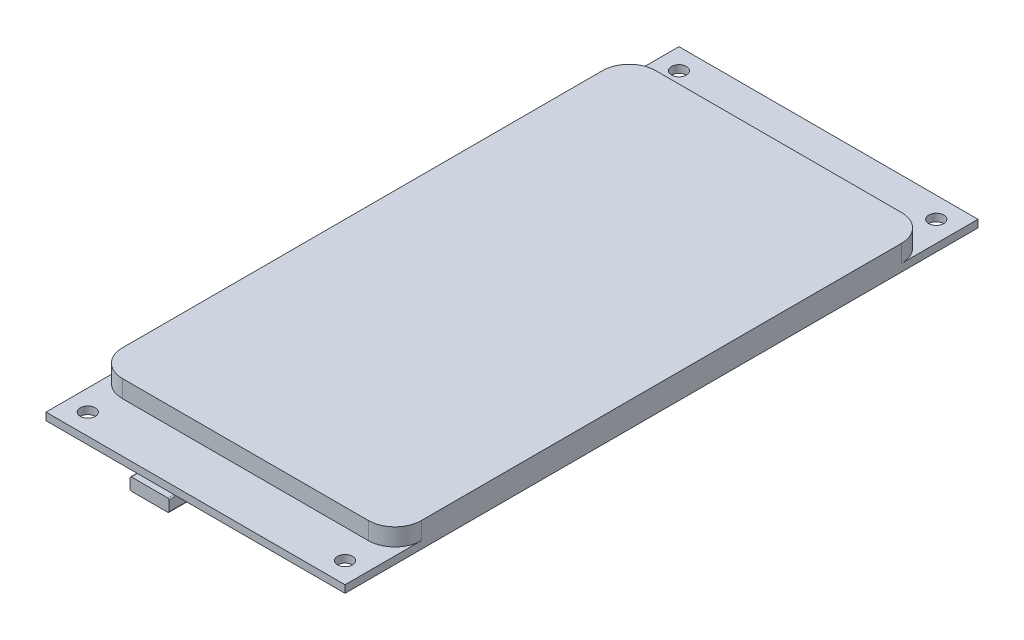
from build123d import *

# Parameters (mm, degrees)
SKETCH1_W            = 60
SKETCH1_H            = 127
BOSS_EXTRUDE1_DEPTH  = 1.5
CUT_EXTRUDE1_REACH   = 142.468
SKETCH2_R            = 1.5
BOSS_EXTRUDE2_DEPTH  = 3.5
BOSS_EXTRUDE3_DEPTH  = 4.8
BOSS_EXTRUDE4_DEPTH  = 1.2
SKETCH5_W            = 14.4
SKETCH5_H            = 2
BOSS_EXTRUDE5_DEPTH  = 14.5
BOSS_EXTRUDE6_DEPTH  = 1.4
BOSS_EXTRUDE7_DEPTH  = 7.6
SKETCH7_W            = 6.4
SKETCH7_H            = 5.3
BOSS_EXTRUDE8_DEPTH  = 15
SKETCH8_R            = 2.45
BOSS_EXTRUDE9_DEPTH  = 1
SKETCH5_2_W          = 14.4
SKETCH5_2_H          = 2
BOSS_EXTRUDE10_DEPTH = 0.25
SKETCH9_W            = 5.8
SKETCH9_H            = 12
BOSS_EXTRUDE11_DEPTH = 5.8


with BuildPart() as part:
    # Sketch1 → Boss-Extrude1 (new body)
    with BuildSketch(Plane(origin=(0, 0, 0), x_dir=(1, 0, 0), z_dir=(0, 1, 0))):
        with Locations((30, 63.5)):
            Rectangle(SKETCH1_W, SKETCH1_H)
    extrude(amount=BOSS_EXTRUDE1_DEPTH)

    # Sketch2 → Cut-Extrude1 (cut, up to next)
    with BuildSketch(Plane(origin=(0, 1.5, 0), x_dir=(1, 0, 0), z_dir=(0, 1, 0)), mode=Mode.PRIVATE) as cut_extrude1_sk1:
        with Locations((4.19, 122.81)):
            Circle(SKETCH2_R)
    cut_extrude1_tool1 = extrude(cut_extrude1_sk1.sketch, amount=-CUT_EXTRUDE1_REACH, mode=Mode.PRIVATE) & part.part
    # Sketch2 → Cut-Extrude1 (cut, up to next)
    with BuildSketch(Plane(origin=(0, 1.5, 0), x_dir=(1, 0, 0), z_dir=(0, 1, 0)), mode=Mode.PRIVATE) as cut_extrude1_sk2:
        with Locations((55.81, 122.81)):
            Circle(SKETCH2_R)
    cut_extrude1_tool2 = extrude(cut_extrude1_sk2.sketch, amount=-CUT_EXTRUDE1_REACH, mode=Mode.PRIVATE) & part.part
    # Sketch2 → Cut-Extrude1 (cut, up to next)
    with BuildSketch(Plane(origin=(0, 1.5, 0), x_dir=(1, 0, 0), z_dir=(0, 1, 0)), mode=Mode.PRIVATE) as cut_extrude1_sk3:
        with Locations((4.19, 4.19)):
            Circle(SKETCH2_R)
    cut_extrude1_tool3 = extrude(cut_extrude1_sk3.sketch, amount=-CUT_EXTRUDE1_REACH, mode=Mode.PRIVATE) & part.part
    # Sketch2 → Cut-Extrude1 (cut, up to next)
    with BuildSketch(Plane(origin=(0, 1.5, 0), x_dir=(1, 0, 0), z_dir=(0, 1, 0)), mode=Mode.PRIVATE) as cut_extrude1_sk4:
        with Locations((55.81, 4.19)):
            Circle(SKETCH2_R)
    cut_extrude1_tool4 = extrude(cut_extrude1_sk4.sketch, amount=-CUT_EXTRUDE1_REACH, mode=Mode.PRIVATE) & part.part
    add(cut_extrude1_tool1.solids().sort_by_distance((4.19, 1.5, -122.81))[0], mode=Mode.SUBTRACT)
    add(cut_extrude1_tool2.solids().sort_by_distance((55.81, 1.5, -122.81))[0], mode=Mode.SUBTRACT)
    add(cut_extrude1_tool3.solids().sort_by_distance((4.19, 1.5, -4.19))[0], mode=Mode.SUBTRACT)
    add(cut_extrude1_tool4.solids().sort_by_distance((55.81, 1.5, -4.19))[0], mode=Mode.SUBTRACT)

    # Sketch3 → Boss-Extrude2 (add)
    with BuildSketch(Plane(origin=(0, 1.5, 0), x_dir=(1, 0, 0), z_dir=(0, 1, 0))):
        with BuildLine():
            Line((5.324675365, 117), (54.675324635, 117))
            ThreePointArc((54.675324635, 117), (58.440438693, 115.440438693), (60, 111.675324635))
            Line((60, 111.675324635), (60, 15.324675365))
            ThreePointArc((60, 15.324675365), (58.440438693, 11.559561307), (54.675324635, 10))
            Line((54.675324635, 10), (5.324675365, 10))
            ThreePointArc((5.324675365, 10), (1.559561307, 11.559561307), (0, 15.324675365))
            Line((0, 15.324675365), (0, 111.675324635))
            ThreePointArc((0, 111.675324635), (1.559561307, 115.440438693), (5.324675365, 117))
        make_face()
    extrude(amount=BOSS_EXTRUDE2_DEPTH)



with BuildPart() as body_2:
    # Sketch4 → Boss-Extrude3 (new body)
    with BuildSketch(Plane.XY):
        with BuildLine():
            Line((18.35, 0), (25.65, 0))
            ThreePointArc((25.65, 0), (25.826776695, -0.073223305), (25.9, -0.25))
            Line((25.9, -0.25), (25.9, -2.25))
            ThreePointArc((25.9, -2.25), (25.826776695, -2.426776695), (25.65, -2.5))
            Line((25.65, -2.5), (18.35, -2.5))
            ThreePointArc((18.35, -2.5), (18.173223305, -2.426776695), (18.1, -2.25))
            Line((18.1, -2.25), (18.1, -0.25))
            ThreePointArc((18.1, -0.25), (18.173223305, -0.073223305), (18.35, 0))
        make_face()
    extrude(amount=-BOSS_EXTRUDE3_DEPTH)


with BuildPart() as part_1:
    add(part.part)

    add(body_2.part)  # Boss-Extrude4 merges body 2
    # Sketch4<2> → Boss-Extrude4 (add)
    with BuildSketch(Plane.XY):
        with BuildLine():
            Line((18.35, 0), (25.65, 0))
            ThreePointArc((25.65, 0), (25.826776695, -0.073223305), (25.9, -0.25))
            Line((25.9, -0.25), (25.9, -2.25))
            ThreePointArc((25.9, -2.25), (25.826776695, -2.426776695), (25.65, -2.5))
            Line((25.65, -2.5), (18.35, -2.5))
            ThreePointArc((18.35, -2.5), (18.173223305, -2.426776695), (18.1, -2.25))
            Line((18.1, -2.25), (18.1, -0.25))
            ThreePointArc((18.1, -0.25), (18.173223305, -0.073223305), (18.35, 0))
        make_face()
    extrude(amount=BOSS_EXTRUDE4_DEPTH)

    # Sketch5 → Boss-Extrude5 (add)
    with BuildSketch(Plane.ZY):
        with Locations((-35.3, -1)):
            Rectangle(SKETCH5_W, SKETCH5_H)
    extrude(amount=-BOSS_EXTRUDE5_DEPTH)



with BuildPart() as body_2_2:
    # Sketch6 → Boss-Extrude6 (new body)
    with BuildSketch(Plane(origin=(0, 0, -127), x_dir=(-1, 0, 0), z_dir=(0, 0, -1))):
        with BuildLine():
            Line((-28.308670428, 0), (-34.2, 0))
            ThreePointArc((-34.2, 0), (-34.376776695, -0.073223305), (-34.45, -0.25))
            Line((-34.45, -0.25), (-34.45, -1.65))
            ThreePointArc((-34.45, -1.65), (-34.523223305, -1.826776695), (-34.7, -1.9))
            Line((-34.7, -1.9), (-34.75, -1.9))
            ThreePointArc((-34.75, -1.9), (-34.926776695, -1.973223305), (-35, -2.15))
            Line((-35, -2.15), (-35, -3.55))
            ThreePointArc((-35, -3.55), (-34.926776695, -3.726776695), (-34.75, -3.8))
            Line((-34.75, -3.8), (-27.75, -3.8))
            ThreePointArc((-27.75, -3.8), (-27.573223305, -3.726776695), (-27.5, -3.55))
            Line((-27.5, -3.55), (-27.5, -2.15))
            ThreePointArc((-27.5, -2.15), (-27.573223305, -1.973223305), (-27.75, -1.9))
            Line((-27.75, -1.9), (-27.808670428, -1.9))
            ThreePointArc((-27.808670428, -1.9), (-27.985447123, -1.826776695), (-28.058670428, -1.65))
            Line((-28.058670428, -1.65), (-28.058670428, -0.25))
            ThreePointArc((-28.058670428, -0.25), (-28.131893732, -0.073223305), (-28.308670428, 0))
        make_face()
    extrude(amount=BOSS_EXTRUDE6_DEPTH)


with BuildPart() as part_2:
    add(part_1.part)

    add(body_2_2.part)  # Boss-Extrude7 merges body 2 2
    # Sketch6<3> → Boss-Extrude7 (add)
    with BuildSketch(Plane(origin=(0, 0, -127), x_dir=(-1, 0, 0), z_dir=(0, 0, -1))):
        with BuildLine():
            Line((-28.308670428, 0), (-34.2, 0))
            ThreePointArc((-34.2, 0), (-34.376776695, -0.073223305), (-34.45, -0.25))
            Line((-34.45, -0.25), (-34.45, -1.65))
            ThreePointArc((-34.45, -1.65), (-34.523223305, -1.826776695), (-34.7, -1.9))
            Line((-34.7, -1.9), (-34.75, -1.9))
            ThreePointArc((-34.75, -1.9), (-34.926776695, -1.973223305), (-35, -2.15))
            Line((-35, -2.15), (-35, -3.55))
            ThreePointArc((-35, -3.55), (-34.926776695, -3.726776695), (-34.75, -3.8))
            Line((-34.75, -3.8), (-27.75, -3.8))
            ThreePointArc((-27.75, -3.8), (-27.573223305, -3.726776695), (-27.5, -3.55))
            Line((-27.5, -3.55), (-27.5, -2.15))
            ThreePointArc((-27.5, -2.15), (-27.573223305, -1.973223305), (-27.75, -1.9))
            Line((-27.75, -1.9), (-27.808670428, -1.9))
            ThreePointArc((-27.808670428, -1.9), (-27.985447123, -1.826776695), (-28.058670428, -1.65))
            Line((-28.058670428, -1.65), (-28.058670428, -0.25))
            ThreePointArc((-28.058670428, -0.25), (-28.131893732, -0.073223305), (-28.308670428, 0))
        make_face()
    extrude(amount=-BOSS_EXTRUDE7_DEPTH)

    # Sketch7 → Boss-Extrude8 (add)
    with BuildSketch(Plane.ZY):
        with Locations((-102.7, -2.65)):
            Rectangle(SKETCH7_W, SKETCH7_H)
    extrude(amount=-BOSS_EXTRUDE8_DEPTH)

    # Sketch8 → Boss-Extrude9 (add)
    with BuildSketch(Plane.ZY):
        with Locations((-102.7, -2.65)):
            Circle(SKETCH8_R)
    extrude(amount=BOSS_EXTRUDE9_DEPTH)

    # Sketch5<2> → Boss-Extrude10 (add)
    with BuildSketch(Plane.ZY):
        with Locations((-35.3, -1)):
            Rectangle(SKETCH5_2_W, SKETCH5_2_H)
    extrude(amount=BOSS_EXTRUDE10_DEPTH)

    # Sketch9 → Boss-Extrude11 (add)
    with BuildSketch(Plane(origin=(0, 0, -127), x_dir=(-1, 0, 0), z_dir=(0, 0, -1))):
        with Locations((-18.9, -6)):
            Rectangle(SKETCH9_W, SKETCH9_H)
    extrude(amount=-BOSS_EXTRUDE11_DEPTH)


solid = part_2.part
